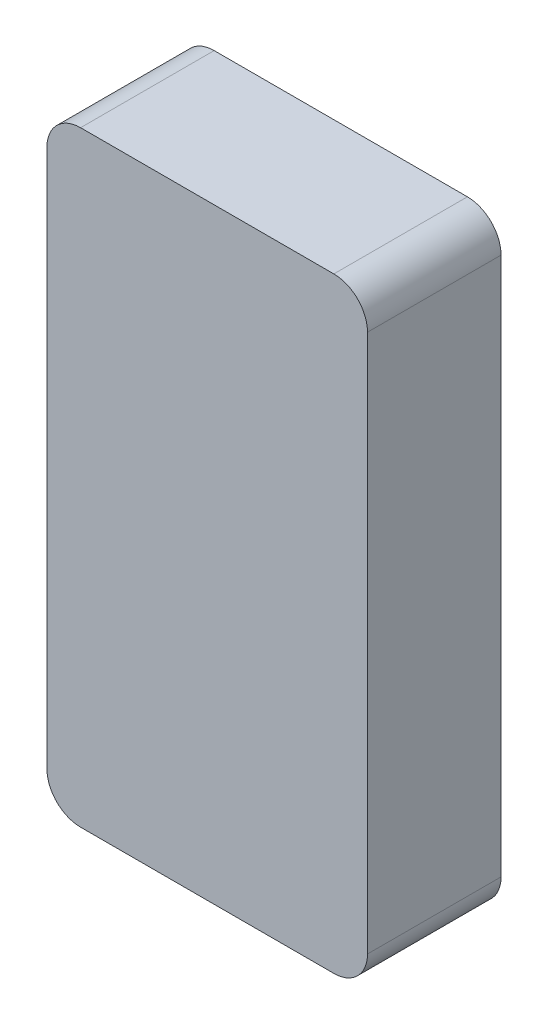
from build123d import *

# Parameters (mm, degrees)
SKETCH1_W           = 4.7625
SKETCH1_H           = 9
BOSS_EXTRUDE1_DEPTH = 1.984375
FILLET1_R           = 0.5
FILLET2_R           = 0.5


with BuildPart() as part:
    # Sketch1 → Boss-Extrude1 (new body)
    with BuildSketch(Plane.XY):
        with Locations((2.38125, 4.5)):
            Rectangle(SKETCH1_W, SKETCH1_H)
    extrude(amount=BOSS_EXTRUDE1_DEPTH)

    # Fillet1
    fillet1_edges = [part.edges().sort_by_distance(p)[0] for p in [
        (0, 9, 0.9921875),
        (4.7625, 9, 0.9921875),
    ]]
    fillet(fillet1_edges, radius=FILLET1_R)

    # Fillet2
    fillet2_edges = [part.edges().sort_by_distance(p)[0] for p in [
        (4.7625, 0, 0.9921875),
        (0, 0, 0.9921875),
    ]]
    fillet(fillet2_edges, radius=FILLET2_R)


solid = part.part
